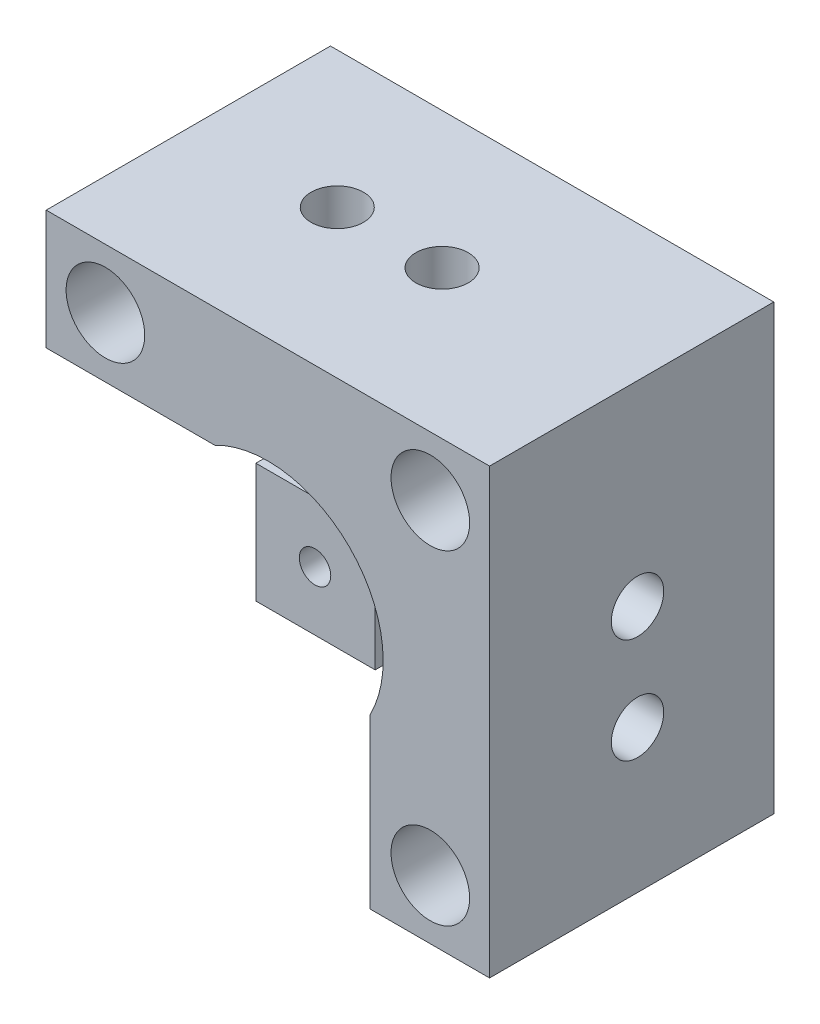
from build123d import *

# Parameters (mm, degrees)
SKETCH1_W               = 42.3
SKETCH1_H               = 42.3
SKETCH1_R               = 11
SKETCH1_R_2             = 1.5
BOSS_EXTRUDE1_DEPTH     = 27.120000001
CUT_EXTRUDE1_REACH      = 56.517
CUT_EXTRUDE1_END_RADIUS = 11
SKETCH2_W               = 19.523532215
SKETCH2_H               = 24.120000001
SKETCH3_R               = 3.75
SKETCH3_R_2             = 12.246536733
CUT_EXTRUDE2_DEPTH      = 20
SKETCH4_R               = 2.5
CUT_EXTRUDE3_DEPTH      = 55.517033119
CUT_EXTRUDE4_START      = -4
SKETCH6_R               = 4
CUT_EXTRUDE4_DEPTH      = 51.517033168


with BuildPart() as part:
    # Sketch1 → Boss-Extrude1 (new body)
    with BuildSketch(Plane.XY):
        Rectangle(SKETCH1_W, SKETCH1_H)
        with Locations(Location((0, 0, 0), (0, 0, 90))):
            Circle(SKETCH1_R, mode=Mode.SUBTRACT)
        with Locations(Location((-15.5, 15.5, 0), (0, 0, 90))):
            Circle(SKETCH1_R_2, mode=Mode.SUBTRACT)
        with Locations(Location((15.5, 15.5, 0), (0, 0, 90))):
            Circle(SKETCH1_R_2, mode=Mode.SUBTRACT)
        with Locations(Location((15.5, -15.5, 0), (0, 0, 90))):
            Circle(SKETCH1_R_2, mode=Mode.SUBTRACT)
        with Locations(Location((-15.5, -15.5, 0), (0, 0, 90))):
            Circle(SKETCH1_R_2, mode=Mode.SUBTRACT)
    extrude(amount=BOSS_EXTRUDE1_DEPTH)

    # Cut-Extrude1: up to this cylinder (the profile starts outside it)
    cut_extrude1_end = Plane(origin=(0, 0, 15.06), z_dir=(0, 0, -1)) * Cylinder(CUT_EXTRUDE1_END_RADIUS, 136.034, mode=Mode.PRIVATE)
    # Sketch2 → Cut-Extrude1 (cut, up to the surface)
    with BuildSketch(Plane.XZ.offset(21.15), mode=Mode.PRIVATE) as cut_extrude1_sk1:
        with Locations((0.000623065, 15.060000001)):
            Rectangle(SKETCH2_W, SKETCH2_H)
    cut_extrude1_tool1 = extrude(cut_extrude1_sk1.sketch, amount=-CUT_EXTRUDE1_REACH, mode=Mode.PRIVATE) - cut_extrude1_end
    cut_extrude1 = cut_extrude1_tool1.solids().sort_by_distance((0.000623, -21.15, 15.06))[0]
    add(cut_extrude1, mode=Mode.SUBTRACT)

    # Sketch3 → Cut-Extrude2 (cut)
    with BuildSketch(Plane.XY.offset(27.120000001)):
        with Locations((15.5, 15.5)):
            Circle(SKETCH3_R)
        with Locations((15.5, -15.5)):
            Circle(SKETCH3_R)
        with Locations((-15.5, 15.5)):
            Circle(SKETCH3_R)
        with Locations((-15.5, -15.5)):
            Circle(SKETCH3_R_2)
    extrude(amount=-CUT_EXTRUDE2_DEPTH, mode=Mode.SUBTRACT)

    # Sketch4 → Cut-Extrude3 (cut, through all)
    with BuildSketch(Plane(origin=(0, 21.15, 0), x_dir=(1, 0, 0), z_dir=(0, 1, 0))):
        with Locations(Location((-7.5, -13, 0), (0, 0, 270))):
            Circle(SKETCH4_R)
        with Locations(Location((2.5, -13, 0), (0, 0, 270))):
            Circle(SKETCH4_R)
    cut_extrude3 = extrude(amount=-CUT_EXTRUDE3_DEPTH, mode=Mode.SUBTRACT)

    # Sketch6 → Cut-Extrude4 (cut, through all)
    with BuildSketch(Plane(origin=(0, 21.15, 0), x_dir=(1, 0, 0), z_dir=(0, 1, 0)).offset(CUT_EXTRUDE4_START)):
        with Locations(Location((2.5, -13, 0), (0, 0, 270))):
            Circle(SKETCH6_R)
        with Locations(Location((-7.5, -13, 0), (0, 0, 270))):
            Circle(SKETCH6_R)
    cut_extrude4 = extrude(amount=-CUT_EXTRUDE4_DEPTH, mode=Mode.SUBTRACT)

    # Mirror1: Cut-Extrude1, Cut-Extrude3, Cut-Extrude4 across plane
    add(cut_extrude1.mirror(Plane(origin=(0, 0, 0), x_dir=(0, 0, 1), z_dir=(-0.7071067811865464, 0.7071067811865488, 0))), mode=Mode.SUBTRACT)
    add(cut_extrude3.mirror(Plane(origin=(0, 0, 0), x_dir=(0, 0, 1), z_dir=(-0.7071067811865464, 0.7071067811865488, 0))), mode=Mode.SUBTRACT)
    add(cut_extrude4.mirror(Plane(origin=(0, 0, 0), x_dir=(0, 0, 1), z_dir=(-0.7071067811865464, 0.7071067811865488, 0))), mode=Mode.SUBTRACT)


solid = part.part
